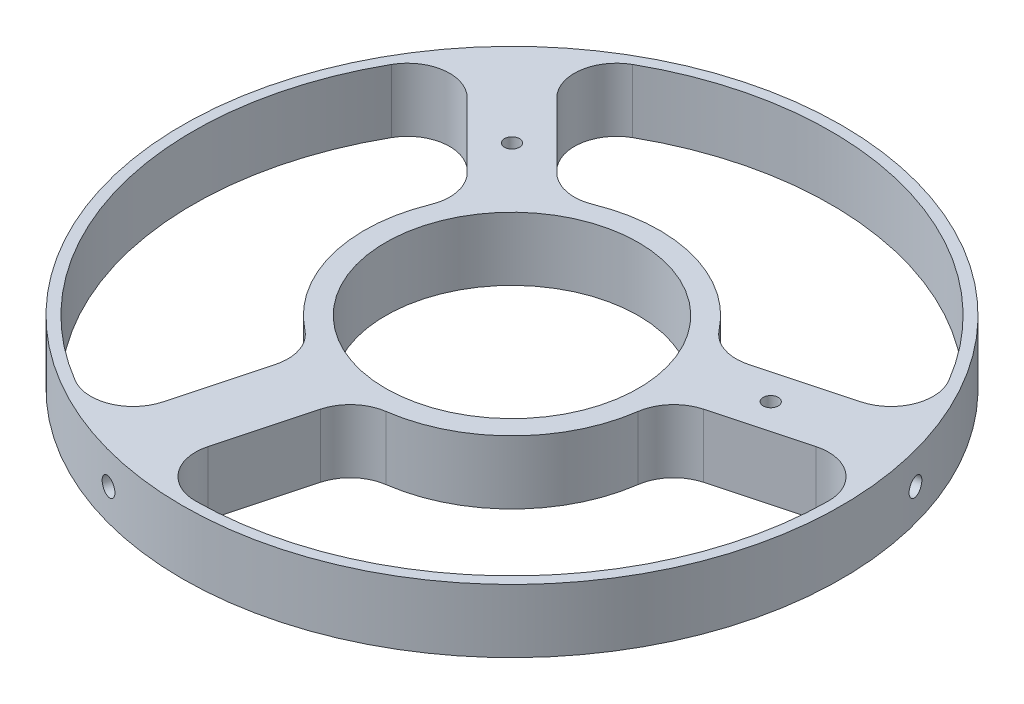
from build123d import *

# Parameters (mm, degrees)
SKETCH2_R                = 49.53
BOSS_EXTRUDE1_DEPTH      = 9.525
CUT_EXTRUDE1_REACH       = 72.691
SKETCH3_R                = 19
CIRPATTERN1_COUNT        = 3
CUT_EXTRUDE3_REACH       = 72.691
FILLET2_R                = 6.35
CIRPATTERN2_COUNT        = 3
FILLET2_OF_CIRPATTERN2_R = 6.35
F_4_40_TAPPED_HOLE1_D    = 2.2606


with BuildPart() as part:
    # Sketch2 → Boss-Extrude1 (new body)
    with BuildSketch(Plane(origin=(0, 0, 0), x_dir=(1, 0, 0), z_dir=(0, 1, 0))):
        with Locations(Location((0, 0, 0), (0, 0, 90))):
            Circle(SKETCH2_R)
    extrude(amount=BOSS_EXTRUDE1_DEPTH)

    # Sketch3 → Cut-Extrude1 (cut, up to next)
    with BuildSketch(Plane(origin=(0, 9.525, 0), x_dir=(1, 0, 0), z_dir=(0, 1, 0)), mode=Mode.PRIVATE) as cut_extrude1_sk1:
        with Locations(Location((0, 0, 0), (0, 0, 270))):
            Circle(SKETCH3_R)
    cut_extrude1_tool1 = extrude(cut_extrude1_sk1.sketch, amount=-CUT_EXTRUDE1_REACH, mode=Mode.PRIVATE) & part.part
    add(cut_extrude1_tool1.solids().sort_by_distance((0, 9.525, 0))[0], mode=Mode.SUBTRACT)

    # Sketch7 → Tap Drill for #6-32 Tap1 (revolve, cut)
    with BuildSketch(Plane(origin=(-35.022998872, 4.7625, -35.022998872), x_dir=(-0.7071067811865475, 0, 0.7071067811865476), z_dir=(0, 1, 0))):
        Polygon((0, 0), (0, 14.78269403), (1.35255, 13.97), (1.35255, 0), align=None)
    tap_drill_for_6_32_tap1 = revolve(axis=Axis((-41.488783279, 4.7625, -41.488783279), (0.7071067811865474, 0, 0.7071067811865477)), mode=Mode.SUBTRACT)

    # CirPattern1: Tap Drill for #6-32 Tap1 ×3 about axis
    cirpattern1_axis = Axis((0, -0.001, 0), (0, 1, 0))
    for i in range(1, CIRPATTERN1_COUNT):
        add(tap_drill_for_6_32_tap1.rotate(cirpattern1_axis, i * 360 / CIRPATTERN1_COUNT), mode=Mode.SUBTRACT)

    # Sketch8 → Cut-Extrude3 (cut, up to next)
    with BuildSketch(Plane(origin=(0, 9.525, 0), x_dir=(1, 0, 0), z_dir=(0, 1, 0)), mode=Mode.PRIVATE) as cut_extrude3_sk1:
        with BuildLine():
            Line((-30.365191417, 37.100383508), (-11.946600289, 18.68179238))
            ThreePointArc((-11.946600289, 18.68179238), (5.739312325, 21.419405198), (19.686955529, 10.205606645))
            Line((19.686955529, 10.205606645), (44.847218912, 16.947278899))
            ThreePointArc((44.847218912, 16.947278899), (12.40843207, 46.308898927), (-30.365191417, 37.100383508))
        make_face()
    cut_extrude3_tool1 = extrude(cut_extrude3_sk1.sketch, amount=-CUT_EXTRUDE3_REACH, mode=Mode.PRIVATE) & part.part
    cut_extrude3 = cut_extrude3_tool1.solids().sort_by_distance((8.258895, 9.525, -30.822615))[0]
    add(cut_extrude3, mode=Mode.SUBTRACT)

    # Fillet2
    fillet2_edges = [part.edges().sort_by_distance(p)[0] for p in [
        (-30.365191417, 4.7625, -37.100383508),
        (44.847218912, 4.7625, -16.947278899),
        (19.686955529, 4.7625, -10.205606645),
        (-11.946600289, 4.7625, -18.68179238),
    ]]
    fillet(fillet2_edges, radius=FILLET2_R)

    # CirPattern2: Cut-Extrude3 ×3 about axis
    cirpattern2_axis = Axis((0, 0, 0), (0, 1, 0))
    for i in range(1, CIRPATTERN2_COUNT):
        add(cut_extrude3.rotate(cirpattern2_axis, i * 360 / CIRPATTERN2_COUNT), mode=Mode.SUBTRACT)

    # Fillet2 of CirPattern2
    fillet2_of_cirpattern2_edges = [part.edges().sort_by_distance(p)[0] for p in [
        (-16.947278899, 4.7625, 44.847218912),
        (-37.100383508, 4.7625, -30.365191417),
        (-18.68179238, 4.7625, -11.946600289),
        (-10.205606645, 4.7625, 19.686955529),
        (47.312470317, 4.7625, -7.746835404),
        (-7.746835404, 4.7625, 47.312470317),
        (-1.005163149, 4.7625, 22.152206934),
        (22.152206934, 4.7625, -1.005163149),
    ]]
    fillet(fillet2_of_cirpattern2_edges, radius=FILLET2_OF_CIRPATTERN2_R)

    # #4-40 Tapped Hole1 (through all)
    with Locations(Plane(origin=(0, 9.525, 0), x_dir=(1, 0, 0), z_dir=(0, 1, 0))):
        with Locations((30.668144985, 8.217504682), (-22.450640303, 22.450640303)):
            Hole(F_4_40_TAPPED_HOLE1_D / 2)


solid = part.part
